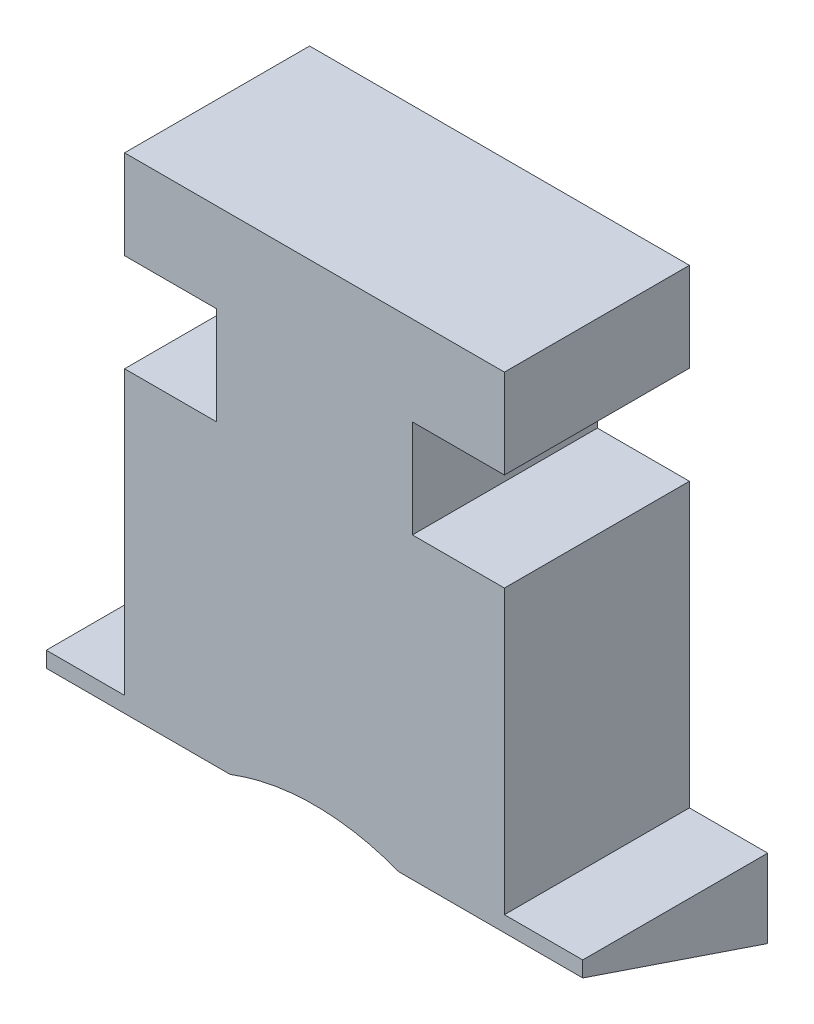
from build123d import *

# Parameters (mm, degrees)
SKETCH1_W           = 12.319
SKETCH1_H           = 6
BOSS_EXTRUDE1_DEPTH = 15.24
SKETCH1_3_W         = 17.399
SKETCH1_3_H         = 6
BOSS_EXTRUDE2_DEPTH = 2.54
SKETCH2_W           = 2.9845
SKETCH2_H           = 3.175
CUT_EXTRUDE1_DEPTH  = 19.545589779
CUT_EXTRUDE2_DEPTH  = 24.323438876
SKETCH4_R           = 7.62
CUT_EXTRUDE3_DEPTH  = 3.175


with BuildPart() as part:
    # Sketch1 → Boss-Extrude1 (new body)
    with BuildSketch(Plane(origin=(0, 0, 0), x_dir=(1, 0, 0), z_dir=(0, 1, 0))):
        Rectangle(SKETCH1_W, SKETCH1_H)
    extrude(amount=BOSS_EXTRUDE1_DEPTH)

    # Sketch1<3> → Boss-Extrude2 (add)
    with BuildSketch(Plane(origin=(0, 0, 0), x_dir=(1, 0, 0), z_dir=(0, 1, 0))):
        Rectangle(SKETCH1_3_W, SKETCH1_3_H)
    extrude(amount=-BOSS_EXTRUDE2_DEPTH)

    # Sketch2 → Cut-Extrude1 (cut, through all)
    with BuildSketch(Plane(origin=(0, 0, -3), x_dir=(-1, 0, 0), z_dir=(0, 0, -1))):
        with Locations((-4.66725, 10.7625)):
            Rectangle(SKETCH2_W, SKETCH2_H)
        with Locations((4.66725, 10.7625)):
            Rectangle(SKETCH2_W, SKETCH2_H)
    extrude(amount=-CUT_EXTRUDE1_DEPTH, mode=Mode.SUBTRACT)

    # Sketch3 → Cut-Extrude2 (cut, through all)
    with BuildSketch(Plane.ZY.offset(8.6995)):
        Polygon((-3, -2.54), (3, -0.508), (3, -2.54), align=None)
    extrude(amount=-CUT_EXTRUDE2_DEPTH, mode=Mode.SUBTRACT)

    # Sketch4 → Cut-Extrude3 (cut)
    with BuildSketch(Plane.XY.offset(3)):
        with Locations((0, -7.62)):
            Circle(SKETCH4_R)
    extrude(amount=-CUT_EXTRUDE3_DEPTH, mode=Mode.SUBTRACT)


solid = part.part
